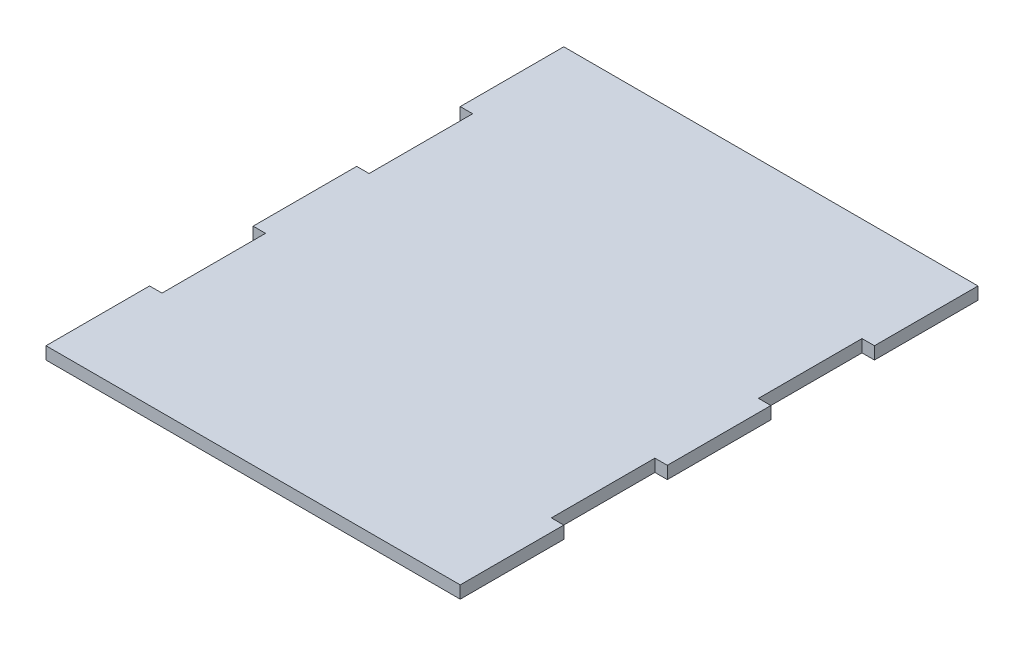
from build123d import *

# Parameters (mm, degrees)
SKETCH1_W           = 200
SKETCH1_H           = 250
BOSS_EXTRUDE1_DEPTH = 6
SKETCH2_W           = 6
SKETCH2_H           = 50
CUT_EXTRUDE1_DEPTH  = 6


with BuildPart() as part:
    # Sketch1 → Boss-Extrude1 (new body)
    with BuildSketch(Plane(origin=(0, 0, 0), x_dir=(1, 0, 0), z_dir=(0, 1, 0))):
        Rectangle(SKETCH1_W, SKETCH1_H)
    extrude(amount=BOSS_EXTRUDE1_DEPTH)

    # Sketch2 → Cut-Extrude1 (cut)
    with BuildSketch(Plane(origin=(0, 6, 0), x_dir=(1, 0, 0), z_dir=(0, 1, 0))):
        with Locations((-97, 50)):
            Rectangle(SKETCH2_W, SKETCH2_H)
        with Locations((97, 50)):
            Rectangle(SKETCH2_W, SKETCH2_H)
        with Locations((97, -50)):
            Rectangle(SKETCH2_W, SKETCH2_H)
        with Locations((-97, -50)):
            Rectangle(SKETCH2_W, SKETCH2_H)
    extrude(amount=-CUT_EXTRUDE1_DEPTH, mode=Mode.SUBTRACT)


solid = part.part
